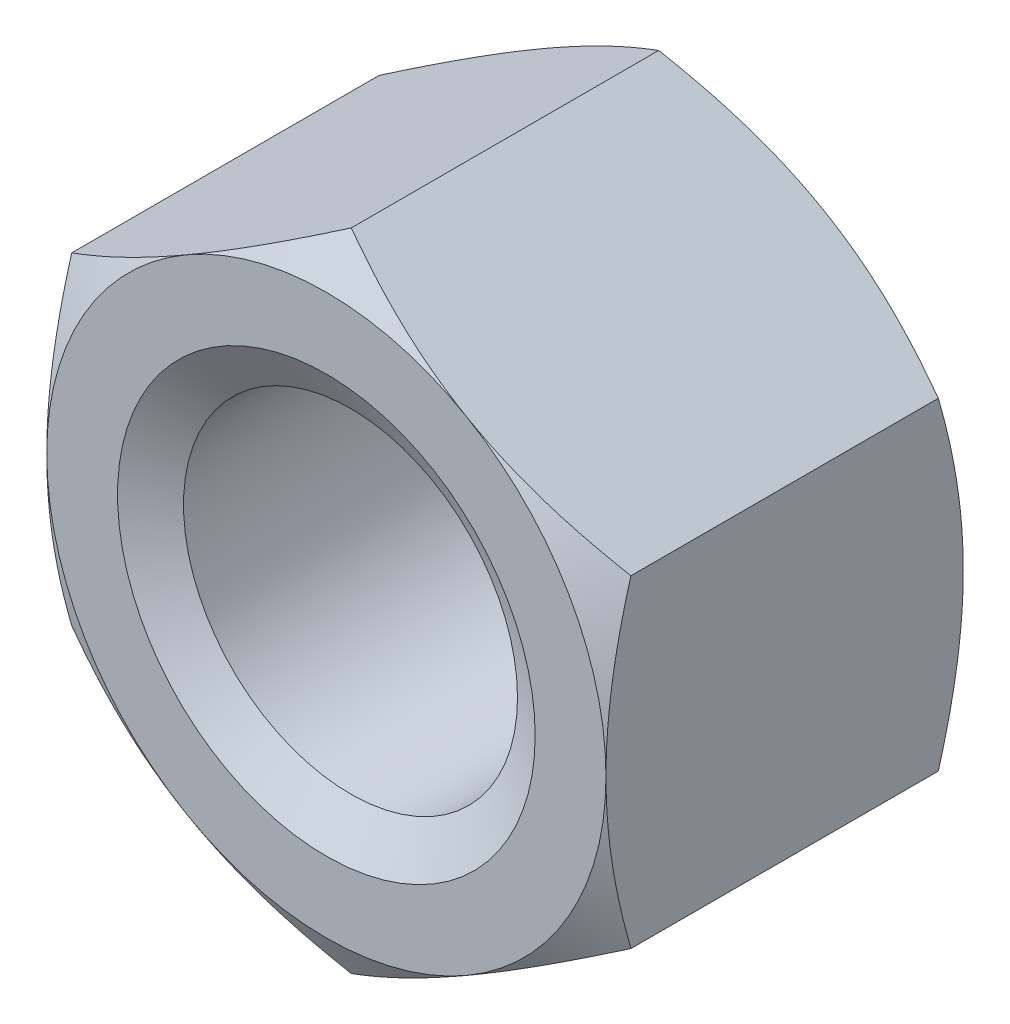
from build123d import *

# Parameters (mm, degrees)
SKETCH_3_R          = 6.9175
EXTRUDE_1_DEPTH     = 14.8
SKETCH_5_R          = 20.0625
SKETCH_5_R_2        = 11.583089776
CUT_EXTRUDE_1_DEPTH = 2.96
CUT_EXTRUDE_1_DRAFT = -60
SKETCH_7_R          = 20.0625
SKETCH_7_R_2        = 11.583089776
CUT_EXTRUDE_2_DEPTH = 2.96
CUT_EXTRUDE_2_DRAFT = -60


with BuildPart() as part:
    # 草图3 → 凸台-拉伸1 (new body)
    with BuildSketch(Plane.XY):
        Polygon((0, 13.375), (-11.583089776, 6.6875), (-11.583089776, -6.6875), (0, -13.375), (11.583089776, -6.6875), (11.583089776, 6.6875), align=None)
        Circle(SKETCH_3_R, mode=Mode.SUBTRACT)
    extrude(amount=-EXTRUDE_1_DEPTH)

    # 草图4 → 切除-旋转1 (revolve, cut)
    with BuildSketch(Plane(origin=(0, 0, 0), x_dir=(0, 0, -1), z_dir=(1, 0, 0)), mode=Mode.PRIVATE) as cut_revolve_1_sk:
        Polygon((0, 8.65), (1.000259341, 6.9175), (1.000259341, 0), (0, 0), align=None)
        Polygon((14.8, 0), (14.8, 8.65), (13.799740659, 6.9175), (13.799740659, 0), align=None)
    revolve(cut_revolve_1_sk.sketch.rotate(Axis((0, 0, 0), (0, 0, -1)), 90), axis=Axis((0, 0, 0), (0, 0, -1)), mode=Mode.SUBTRACT)


with BuildPart() as cut_extrude_1_tool:
    # 草图5 → 切除-拉伸1 (with draft: the straight prism first)
    with BuildSketch(Plane.XY):
        Circle(SKETCH_5_R)
        Circle(SKETCH_5_R_2, mode=Mode.SUBTRACT)
    extrude(amount=-CUT_EXTRUDE_1_DEPTH)
    # 切除-拉伸1: the draft: its side faces are tilted about the plane it starts from
    cut_extrude_1_sides = [cut_extrude_1_tool.faces().sort_by_distance(p)[0] for p in [
        (-20.0625, 0, -1.48),
        (-11.583089776, 0, -1.48),
    ]]
    draft(cut_extrude_1_sides, Plane.XY, CUT_EXTRUDE_1_DRAFT)


with BuildPart() as part_1:
    add(part.part)

    # 切除-拉伸1: cut by cut_extrude_1_tool
    add(cut_extrude_1_tool.part, mode=Mode.SUBTRACT)


with BuildPart() as cut_extrude_2_tool:
    # 草图7 → 切除-拉伸2 (with draft: the straight prism first)
    with BuildSketch(Plane(origin=(0, 0, -14.8), x_dir=(-1, 0, 0), z_dir=(0, 0, -1))):
        Circle(SKETCH_7_R)
        Circle(SKETCH_7_R_2, mode=Mode.SUBTRACT)
    extrude(amount=-CUT_EXTRUDE_2_DEPTH)
    # 切除-拉伸2: the draft: its side faces are tilted about the plane it starts from
    cut_extrude_2_sides = [cut_extrude_2_tool.faces().sort_by_distance(p)[0] for p in [
        (20.0625, 0, -13.32),
        (11.583089776, 0, -13.32),
    ]]
    draft(cut_extrude_2_sides, Plane(origin=(0, 0, -14.8), x_dir=(-1, 0, 0), z_dir=(0, 0, -1)), CUT_EXTRUDE_2_DRAFT)


with BuildPart() as part_2:
    add(part_1.part)

    # 切除-拉伸2: cut by cut_extrude_2_tool
    add(cut_extrude_2_tool.part, mode=Mode.SUBTRACT)


solid = part_2.part
